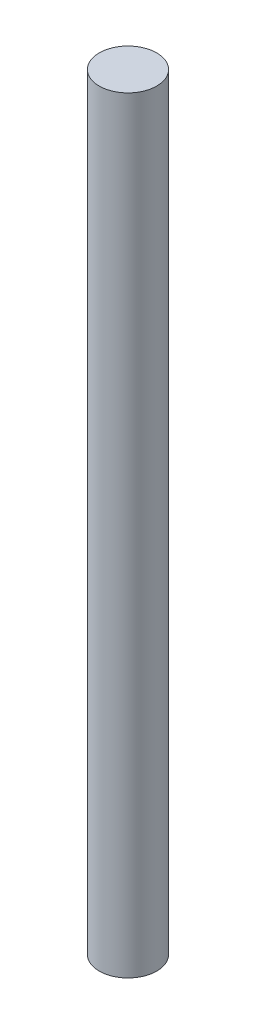
from build123d import *

# Parameters (mm, degrees)
SKETCH2_R           = 75
BOSS_EXTRUDE1_DEPTH = 2000


with BuildPart() as part:
    # Sketch2 → Boss-Extrude1 (new body)
    with BuildSketch(Plane(origin=(0, 0, 0), x_dir=(1, 0, 0), z_dir=(0, 1, 0))):
        with Locations(Location((-289.008733796, -81.332648836, 0), (0, 0, 270))):
            Circle(SKETCH2_R)
    extrude(amount=BOSS_EXTRUDE1_DEPTH)


solid = part.part
